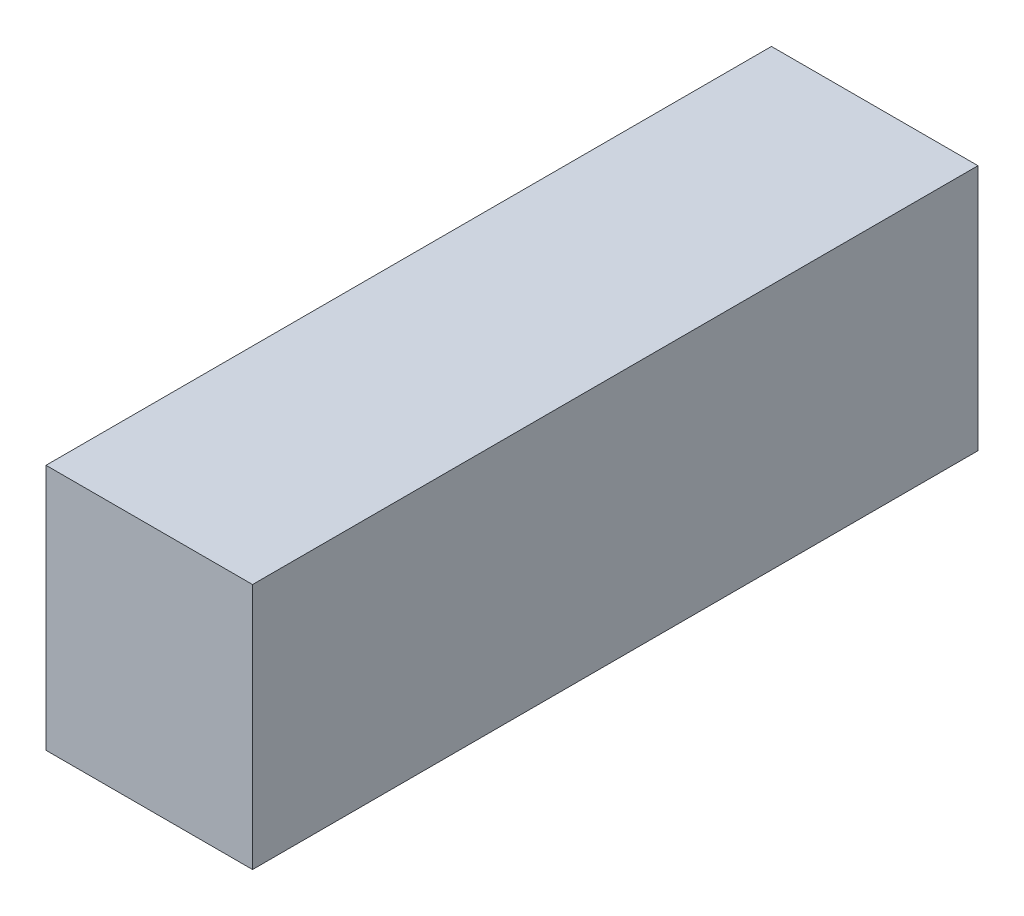
from build123d import *

# Parameters (mm, degrees)
SKETCH1_W           = 41
SKETCH1_H           = 144
BOSS_EXTRUDE1_DEPTH = 49


with BuildPart() as part:
    # Sketch1 → Boss-Extrude1 (new body)
    with BuildSketch(Plane(origin=(0, 0, 0), x_dir=(1, 0, 0), z_dir=(0, 1, 0))):
        Rectangle(SKETCH1_W, SKETCH1_H)
    extrude(amount=BOSS_EXTRUDE1_DEPTH)


solid = part.part
